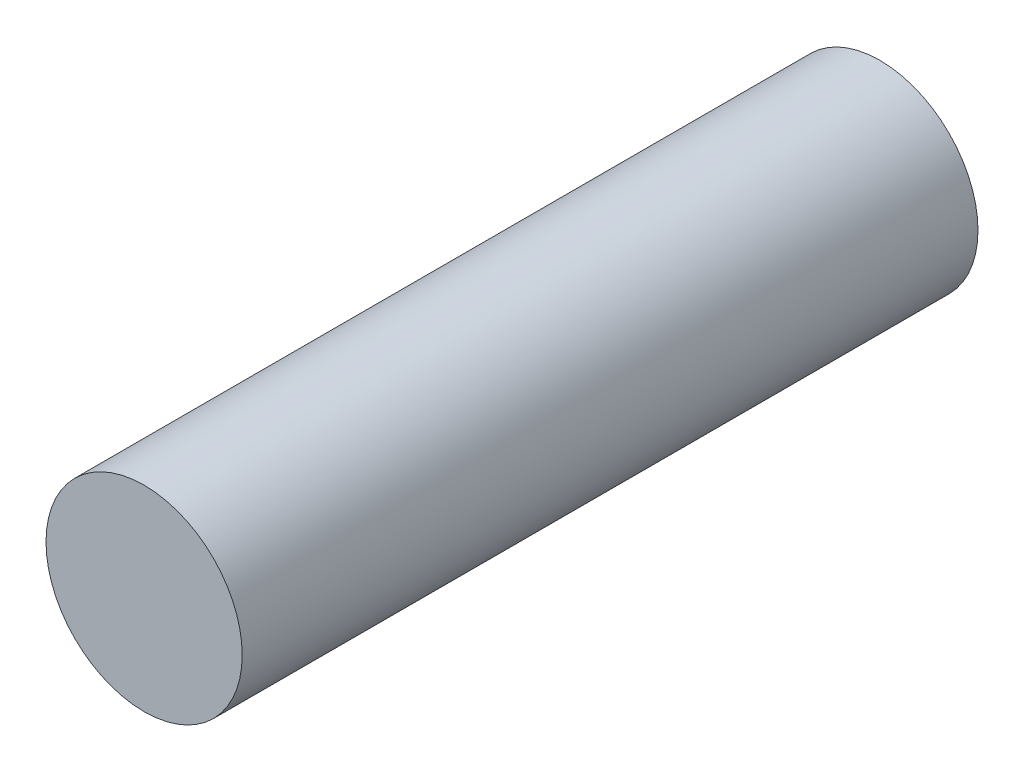
from build123d import *

# Parameters (mm, degrees)
ESBO_O1_R                = 1
RESSALTO_EXTRUS_O1_DEPTH = 7.5


with BuildPart() as part:
    # Esboço1 → Ressalto-extrusão1 (new body)
    with BuildSketch(Plane.XY):
        Circle(ESBO_O1_R)
    extrude(amount=RESSALTO_EXTRUS_O1_DEPTH)


solid = part.part
